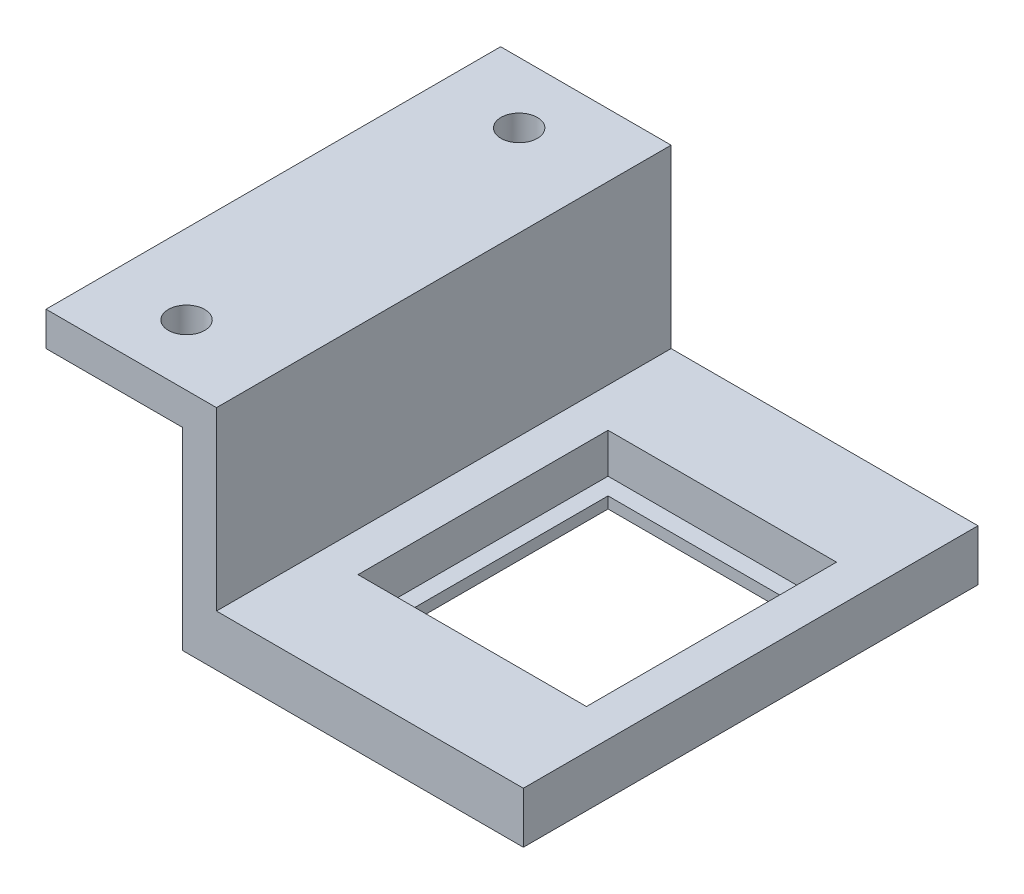
from build123d import *

# Parameters (mm, degrees)
BOSS_EXTRUDE1_DEPTH = 40
SKETCH2_W           = 20.1
SKETCH2_H           = 22
CUT_EXTRUDE1_DEPTH  = 3.5
SKETCH3_W           = 17.1
SKETCH3_H           = 19
CUT_EXTRUDE2_DEPTH  = 54.488316481
SKETCH4_R           = 1.6
CUT_EXTRUDE3_DEPTH  = 54.851648071


with BuildPart() as part:
    # Sketch1 → Boss-Extrude1 (new body)
    with BuildSketch(Plane.XY):
        Polygon((0, 0), (0, 17), (-12, 17), (-12, 20), (3, 20), (3, 4.5), (30, 4.5), (30, 0), align=None)
    extrude(amount=-BOSS_EXTRUDE1_DEPTH)

    # Sketch2 → Cut-Extrude1 (cut)
    with BuildSketch(Plane(origin=(0, 4.5, 0), x_dir=(1, 0, 0), z_dir=(0, 1, 0))):
        with Locations((16.5, 20)):
            Rectangle(SKETCH2_W, SKETCH2_H)
    extrude(amount=-CUT_EXTRUDE1_DEPTH, mode=Mode.SUBTRACT)

    # Sketch3 → Cut-Extrude2 (cut, through all)
    with BuildSketch(Plane(origin=(0, 1, 0), x_dir=(1, 0, 0), z_dir=(0, 1, 0))):
        with Locations((16.5, 20)):
            Rectangle(SKETCH3_W, SKETCH3_H)
    extrude(amount=-CUT_EXTRUDE2_DEPTH, mode=Mode.SUBTRACT)

    # Sketch4 → Cut-Extrude3 (cut, through all)
    with BuildSketch(Plane(origin=(0, 20, 0), x_dir=(1, 0, 0), z_dir=(0, 1, 0))):
        with Locations((-5, 34.63)):
            Circle(SKETCH4_R)
        with Locations((-5, 5.366)):
            Circle(SKETCH4_R)
    extrude(amount=-CUT_EXTRUDE3_DEPTH, mode=Mode.SUBTRACT)


solid = part.part
